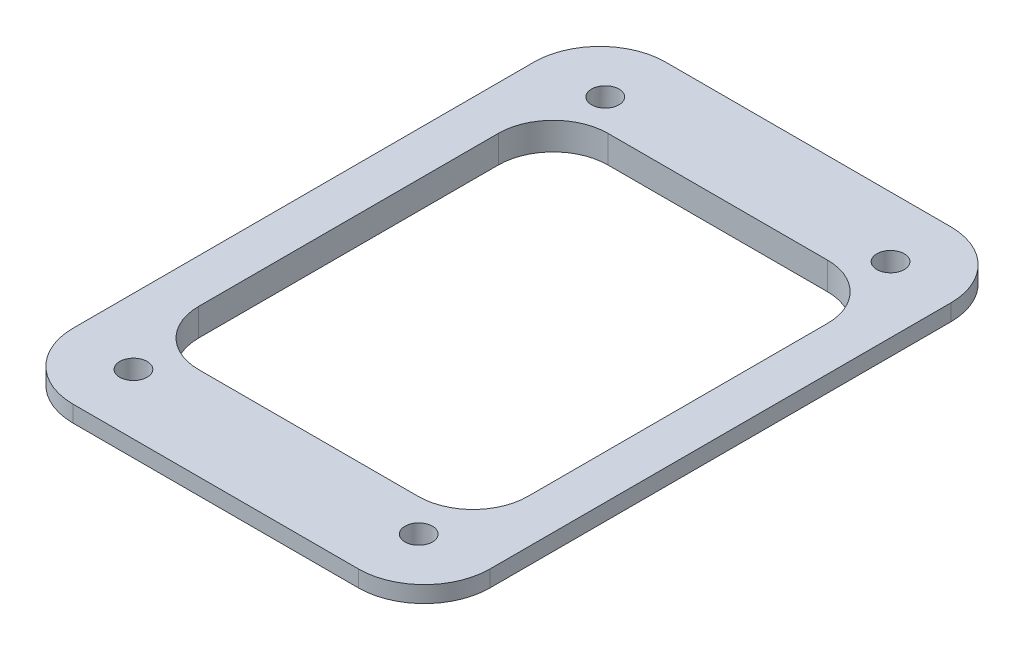
from build123d import *

# Parameters (mm, degrees)
ESTRUSIONE_ESTRUSIONE1_DEPTH = 1
ESTRUSIONE_ESTRUSIONE2_DEPTH = 1.5
SCHIZZO4_W                   = 20.34
SCHIZZO4_H                   = 2.54
TAGLIO_ESTRUSIONE1_DEPTH     = 1.5
SCHIZZO5_R                   = 1.25
TAGLIO_ESTRUSIONE2_DEPTH     = 10


with BuildPart() as part:
    # Schizzo2 → Estrusione-Estrusione1 (new body)
    with BuildSketch(Plane(origin=(0, 0, 0), x_dir=(1, 0, 0), z_dir=(0, 1, 0))):
        with BuildLine():
            Line((-3, 0), (-31, 0))
            ThreePointArc((-31, 0), (-33.121320344, 0.878679656), (-34, 3))
            Line((-34, 3), (-34, 47))
            ThreePointArc((-34, 47), (-33.121320344, 49.121320344), (-31, 50))
            Line((-31, 50), (-3, 50))
            ThreePointArc((-3, 50), (-0.878679656, 49.121320344), (0, 47))
            Line((0, 47), (0, 3))
            ThreePointArc((0, 3), (-0.878679656, 0.878679656), (-3, 0))
        make_face()
        with BuildLine():
            Line((-27, 43.75), (-7, 43.75))
            ThreePointArc((-7, 43.75), (-3.464466094, 42.285533906), (-2, 38.75))
            Line((-2, 38.75), (-2, 11.45))
            ThreePointArc((-2, 11.45), (-3.464466094, 7.914466094), (-7, 6.45))
            Line((-7, 6.45), (-27, 6.45))
            ThreePointArc((-27, 6.45), (-30.535533906, 7.914466094), (-32, 11.45))
            Line((-32, 11.45), (-32, 38.75))
            ThreePointArc((-32, 38.75), (-30.535533906, 42.285533906), (-27, 43.75))
        make_face(mode=Mode.SUBTRACT)
    extrude(amount=ESTRUSIONE_ESTRUSIONE1_DEPTH)

    # Schizzo3 → Estrusione-Estrusione2 (add)
    with BuildSketch(Plane(origin=(0, 1, 0), x_dir=(1, 0, 0), z_dir=(0, 1, 0))):
        with BuildLine():
            Line((-30, 52), (-4, 52))
            ThreePointArc((-4, 52), (0.242640687, 50.242640687), (2, 46))
            Line((2, 46), (2, 4))
            ThreePointArc((2, 4), (0.242640687, -0.242640687), (-4, -2))
            Line((-4, -2), (-30, -2))
            ThreePointArc((-30, -2), (-34.242640687, -0.242640687), (-36, 4))
            Line((-36, 4), (-36, 46))
            ThreePointArc((-36, 46), (-34.242640687, 50.242640687), (-30, 52))
        make_face()
        with BuildLine():
            Line((-27, 6.45), (-7, 6.45))
            ThreePointArc((-7, 6.45), (-3.464466094, 7.914466094), (-2, 11.45))
            Line((-2, 11.45), (-2, 38.75))
            ThreePointArc((-2, 38.75), (-3.464466094, 42.285533906), (-7, 43.75))
            Line((-7, 43.75), (-27, 43.75))
            ThreePointArc((-27, 43.75), (-30.535533906, 42.285533906), (-32, 38.75))
            Line((-32, 38.75), (-32, 11.45))
            ThreePointArc((-32, 11.45), (-30.535533906, 7.914466094), (-27, 6.45))
        make_face(mode=Mode.SUBTRACT)
    extrude(amount=ESTRUSIONE_ESTRUSIONE2_DEPTH)

    # Schizzo4 → Taglio-Estrusione1 (cut)
    with BuildSketch(Plane.XZ):
        with Locations((-16.995, -47.1)):
            Rectangle(SCHIZZO4_W, SCHIZZO4_H)
    extrude(amount=-TAGLIO_ESTRUSIONE1_DEPTH, mode=Mode.SUBTRACT)

    # Schizzo5 → Taglio-Estrusione2 (cut)
    with BuildSketch(Plane(origin=(0, 2.5, 0), x_dir=(1, 0, 0), z_dir=(0, 1, 0))):
        with Locations(Location((-30, 46.5, 0), (0, 0, 270))):
            Circle(SCHIZZO5_R)
        with Locations(Location((-4, 46.5, 0), (0, 0, 270))):
            Circle(SCHIZZO5_R)
        with Locations(Location((-4, 3.5, 0), (0, 0, 270))):
            Circle(SCHIZZO5_R)
        with Locations(Location((-30, 3.5, 0), (0, 0, 270))):
            Circle(SCHIZZO5_R)
    extrude(amount=-TAGLIO_ESTRUSIONE2_DEPTH, mode=Mode.SUBTRACT)


solid = part.part
